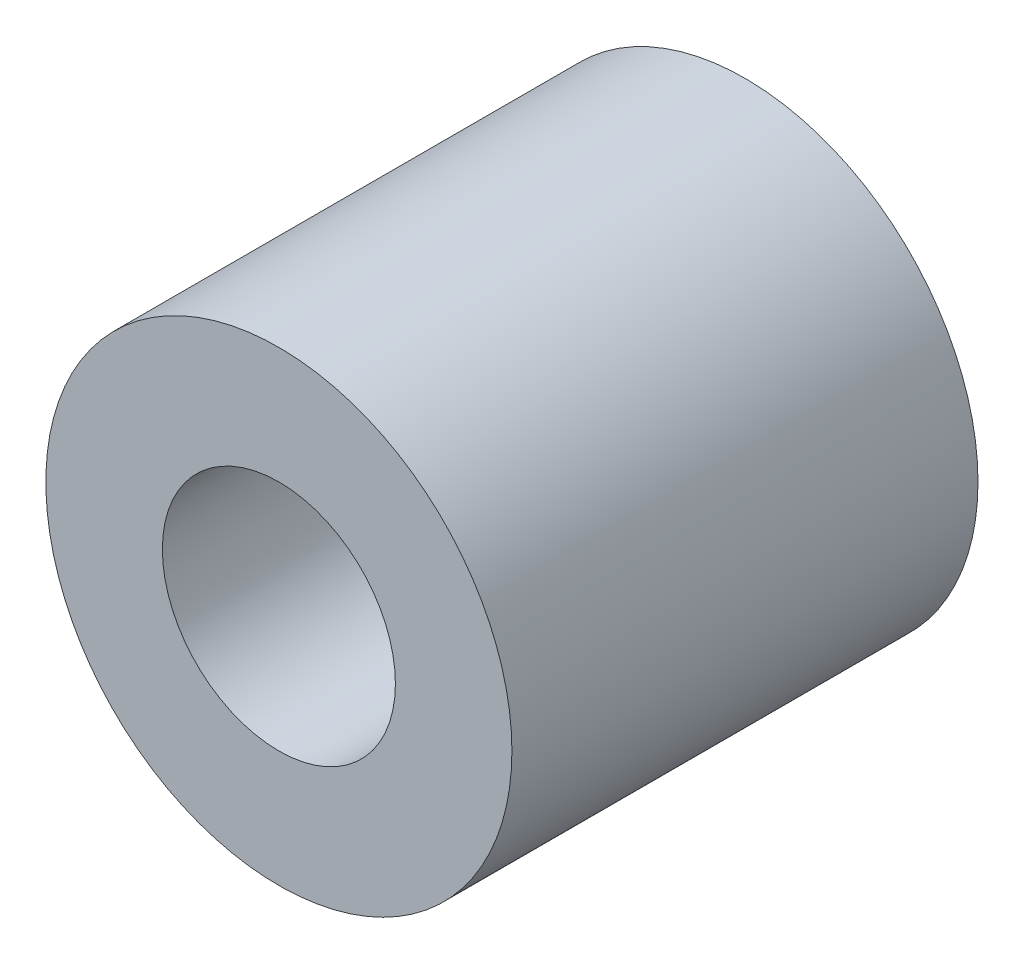
from build123d import *

# Parameters (mm, degrees)
SKETCH1_R           = 6.35
SKETCH1_R_2         = 3.175
BOSS_EXTRUDE1_DEPTH = 12.7


with BuildPart() as part:
    # Sketch1 → Boss-Extrude1 (new body)
    with BuildSketch(Plane.XY):
        with Locations((-27.548683241, 9.611429486)):
            Circle(SKETCH1_R)
        with Locations((-27.548683241, 9.611429486)):
            Circle(SKETCH1_R_2, mode=Mode.SUBTRACT)
    extrude(amount=BOSS_EXTRUDE1_DEPTH)


solid = part.part
